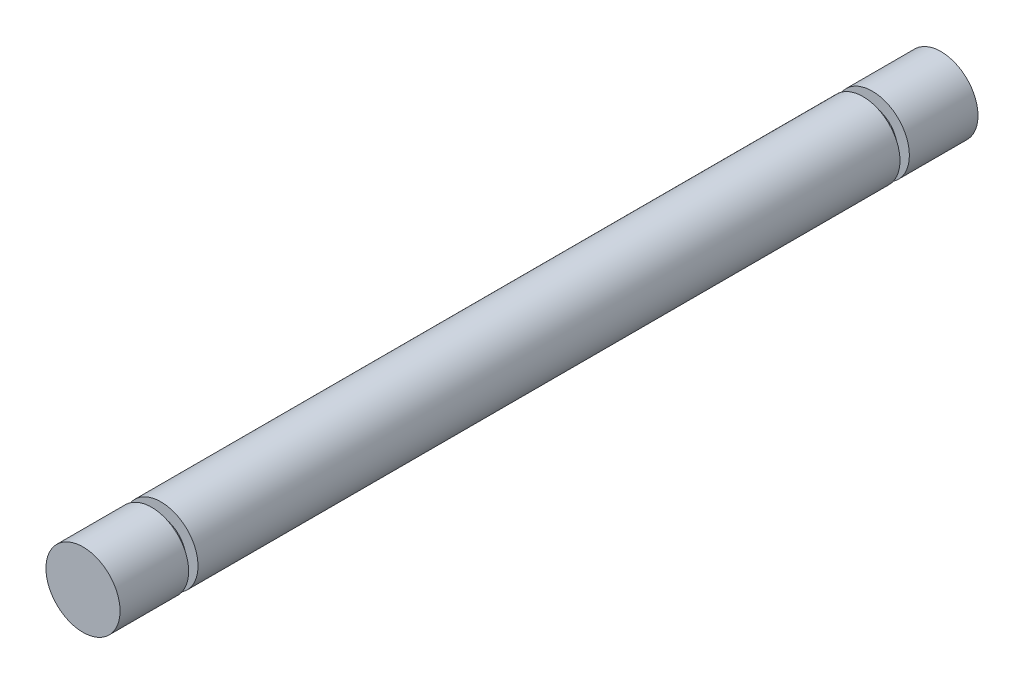
from build123d import *

# Parameters (mm, degrees)
SKETCH1_R           = 2.375
BOSS_EXTRUDE1_DEPTH = 22.5
SKETCH2_R           = 1.6
BOSS_EXTRUDE2_DEPTH = 0.6
SKETCH3_R           = 2.375
BOSS_EXTRUDE3_DEPTH = 4.4


with BuildPart() as part:
    # Sketch1 → Boss-Extrude1 (new body)
    with BuildSketch(Plane.XY):
        with Locations(Location((0, 0, 0), (0, 0, 180))):
            Circle(SKETCH1_R)
    boss_extrude1 = extrude(amount=BOSS_EXTRUDE1_DEPTH)

    # Sketch2 → Boss-Extrude2 (add)
    with BuildSketch(Plane.XY.offset(22.5)):
        Circle(SKETCH2_R)
    boss_extrude2 = extrude(amount=BOSS_EXTRUDE2_DEPTH)

    # Sketch3 → Boss-Extrude3 (add)
    with BuildSketch(Plane.XY.offset(23.1)):
        with Locations(Location((0, 0, 0), (0, 0, 180))):
            Circle(SKETCH3_R)
    boss_extrude3 = extrude(amount=BOSS_EXTRUDE3_DEPTH)

    # Mirror1: Boss-Extrude1, Boss-Extrude2, Boss-Extrude3 across plane
    add(boss_extrude1.mirror(Plane.XY))
    add(boss_extrude2.mirror(Plane.XY))
    add(boss_extrude3.mirror(Plane.XY))


solid = part.part
